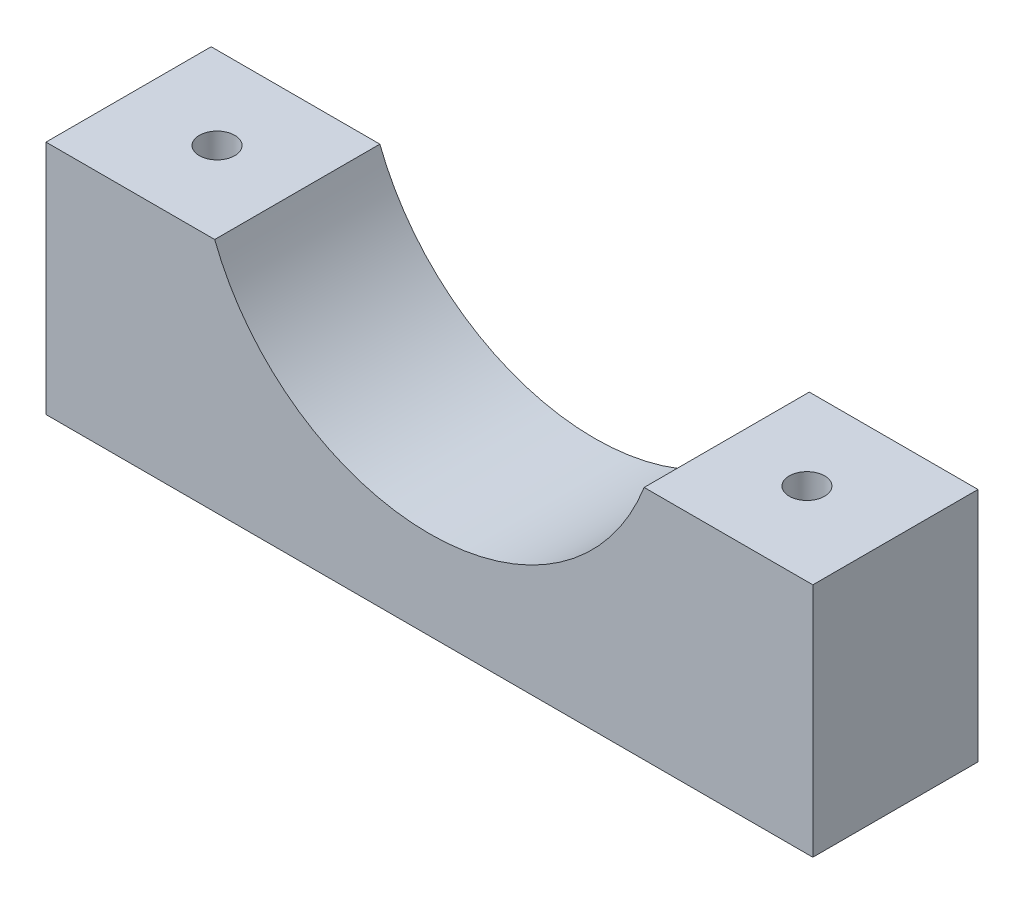
from build123d import *

# Parameters (mm, degrees)
SKETCH1_W           = 65
SKETCH1_H           = 14
BOSS_EXTRUDE1_DEPTH = 20
SKETCH2_R           = 19.5
CUT_EXTRUDE1_DEPTH  = 14
HOLE1_D             = 3


with BuildPart() as part:
    # Sketch1 → Boss-Extrude1 (new body)
    with BuildSketch(Plane(origin=(0, 0, 0), x_dir=(1, 0, 0), z_dir=(0, 1, 0))):
        with Locations((32.5, 7)):
            Rectangle(SKETCH1_W, SKETCH1_H)
    extrude(amount=BOSS_EXTRUDE1_DEPTH)

    # Sketch2 → Cut-Extrude1 (cut)
    with BuildSketch(Plane.XY):
        with Locations((32.5, 27)):
            Circle(SKETCH2_R)
    extrude(amount=-CUT_EXTRUDE1_DEPTH, mode=Mode.SUBTRACT)

    # Hole1 (through all)
    with Locations(Plane(origin=(0, 0, 0), x_dir=(-1, 0, 0), z_dir=(0, -1, 0))):
        with Locations((-57.5, 7), (-7.5, 7)):
            Hole(HOLE1_D / 2)


solid = part.part
